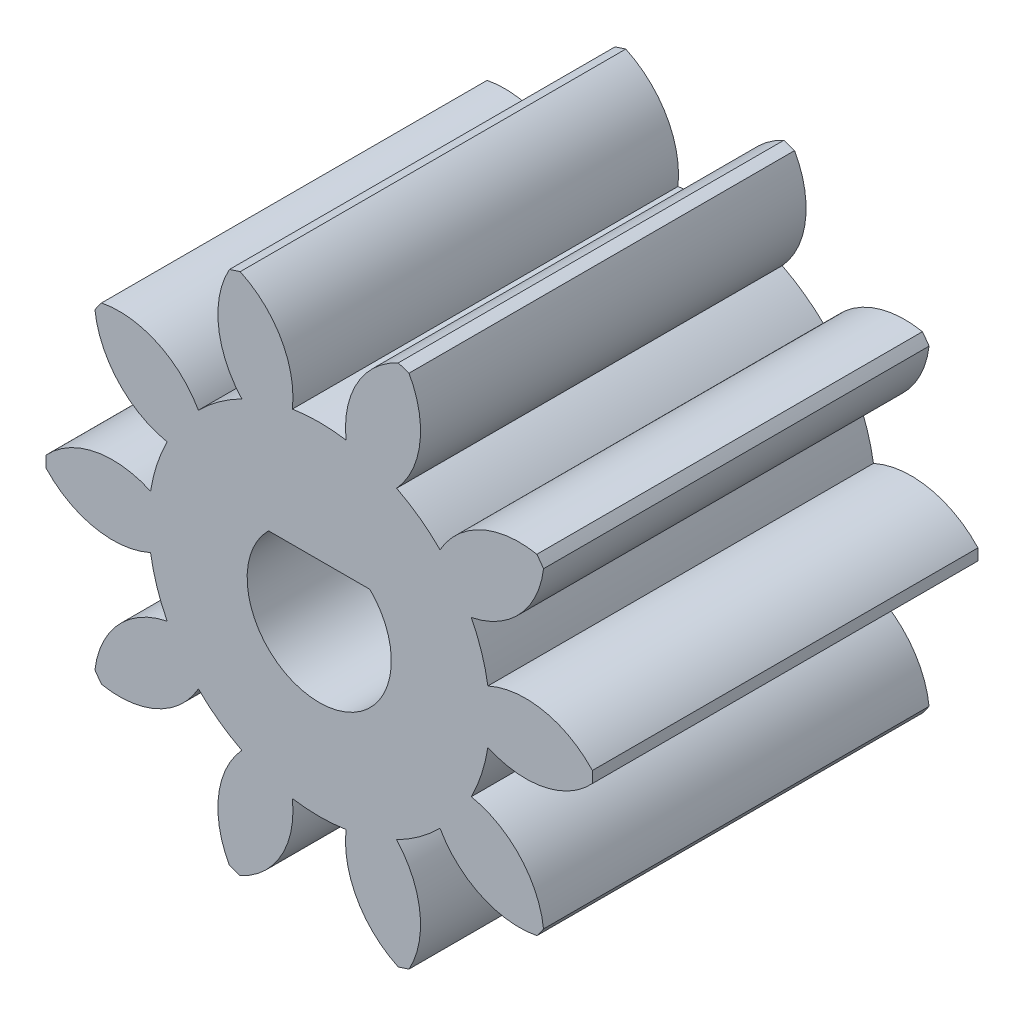
from build123d import *

# Parameters (mm, degrees)
BOSS_EXTRUDE1_DEPTH = 12.7
CUT_EXTRUDE1_REACH  = 19.791


with BuildPart() as part:
    # Sketch1 → Boss-Extrude1 (new body)
    with BuildSketch(Plane.XY):
        with BuildLine():
            ThreePointArc((-7.16977096, 5.440072093), (-7.281152949, 5.290067271), (-7.389397086, 5.137782665))
            ThreePointArc((-7.389397086, 5.137782665), (-6.616232826, 3.46280058), (-5.009138832, 2.556932568))
            ThreePointArc((-5.009138832, 2.556932568), (-5.348741848, 1.737911576), (-5.555405697, 0.875696031))
            ThreePointArc((-5.555405697, 0.875696031), (-7.388027907, 1.087459563), (-8.9980607, 0.186825141))
            ThreePointArc((-8.9980607, 0.186825141), (-9, 0), (-8.9980607, -0.186825141))
            ThreePointArc((-8.9980607, -0.186825141), (-7.388027907, -1.087459563), (-5.555405697, -0.875696031))
            ThreePointArc((-5.555405697, -0.875696031), (-5.348741848, -1.737911576), (-5.009138832, -2.556932568))
            ThreePointArc((-5.009138832, -2.556932568), (-6.616232826, -3.46280058), (-7.389397086, -5.137782665))
            ThreePointArc((-7.389397086, -5.137782665), (-7.281152949, -5.290067271), (-7.16977096, -5.440072093))
            ThreePointArc((-7.16977096, -5.440072093), (-5.337847438, -5.222347115), (-3.979696407, -3.97383851))
            ThreePointArc((-3.979696407, -3.97383851), (-3.305704259, -4.549911576), (-2.549551188, -5.012899834))
            ThreePointArc((-2.549551188, -5.012899834), (-3.317261682, -6.690388598), (-2.958234941, -8.49993212))
            ThreePointArc((-2.958234941, -8.49993212), (-2.781152949, -8.559508647), (-2.602872405, -8.615396407))
            ThreePointArc((-2.602872405, -8.615396407), (-1.248790674, -7.362475569), (-0.883878355, -5.554109745))
            ThreePointArc((-0.883878355, -5.554109745), (0, -5.624), (0.883878355, -5.554109745))
            ThreePointArc((0.883878355, -5.554109745), (1.248790674, -7.362475569), (2.602872405, -8.615396407))
            ThreePointArc((2.602872405, -8.615396407), (2.781152949, -8.559508647), (2.958234941, -8.49993212))
            ThreePointArc((2.958234941, -8.49993212), (3.317261682, -6.690388598), (2.549551188, -5.012899834))
            ThreePointArc((2.549551188, -5.012899834), (3.305704259, -4.549911576), (3.979696407, -3.97383851))
            ThreePointArc((3.979696407, -3.97383851), (5.337847438, -5.222347115), (7.16977096, -5.440072093))
            ThreePointArc((7.16977096, -5.440072093), (7.281152949, -5.290067271), (7.389397086, -5.137782665))
            ThreePointArc((7.389397086, -5.137782665), (6.616232826, -3.46280058), (5.009138832, -2.556932568))
            ThreePointArc((5.009138832, -2.556932568), (5.348741848, -1.737911576), (5.555405697, -0.875696031))
            ThreePointArc((5.555405697, -0.875696031), (7.388027907, -1.087459563), (8.9980607, -0.186825141))
            ThreePointArc((8.9980607, -0.186825141), (9, 0), (8.9980607, 0.186825141))
            ThreePointArc((8.9980607, 0.186825141), (7.388027907, 1.087459563), (5.555405697, 0.875696031))
            ThreePointArc((5.555405697, 0.875696031), (5.348741848, 1.737911576), (5.009138832, 2.556932568))
            ThreePointArc((5.009138832, 2.556932568), (6.616232826, 3.46280058), (7.389397086, 5.137782665))
            ThreePointArc((7.389397086, 5.137782665), (7.281152949, 5.290067271), (7.16977096, 5.440072093))
            ThreePointArc((7.16977096, 5.440072093), (5.337847438, 5.222347115), (3.979696407, 3.97383851))
            ThreePointArc((3.979696407, 3.97383851), (3.305704259, 4.549911576), (2.549551188, 5.012899834))
            ThreePointArc((2.549551188, 5.012899834), (3.317261682, 6.690388598), (2.958234941, 8.49993212))
            ThreePointArc((2.958234941, 8.49993212), (2.781152949, 8.559508647), (2.602872405, 8.615396407))
            ThreePointArc((2.602872405, 8.615396407), (1.248790674, 7.362475569), (0.883878355, 5.554109745))
            ThreePointArc((0.883878355, 5.554109745), (0, 5.624), (-0.883878355, 5.554109745))
            ThreePointArc((-0.883878355, 5.554109745), (-1.248790674, 7.362475569), (-2.602872405, 8.615396407))
            ThreePointArc((-2.602872405, 8.615396407), (-2.781152949, 8.559508647), (-2.958234941, 8.49993212))
            ThreePointArc((-2.958234941, 8.49993212), (-3.317261682, 6.690388598), (-2.549551188, 5.012899834))
            ThreePointArc((-2.549551188, 5.012899834), (-3.305704259, 4.549911576), (-3.979696407, 3.97383851))
            ThreePointArc((-3.979696407, 3.97383851), (-5.337847438, 5.222347115), (-7.16977096, 5.440072093))
        make_face()
    extrude(amount=BOSS_EXTRUDE1_DEPTH)

    # Sketch2 → Cut-Extrude1 (cut, up to next)
    with BuildSketch(Plane.XY.offset(12.7), mode=Mode.PRIVATE) as cut_extrude1_sk1:
        with BuildLine():
            Line((1.669458355, 1.6891), (-1.669458355, 1.6891))
            ThreePointArc((-1.669458355, 1.6891), (0, -2.3749), (1.669458355, 1.6891))
        make_face()
    cut_extrude1_tool1 = extrude(cut_extrude1_sk1.sketch, amount=-CUT_EXTRUDE1_REACH, mode=Mode.PRIVATE) & part.part
    add(cut_extrude1_tool1.solids().sort_by_distance((0, -0.192165, 12.7))[0], mode=Mode.SUBTRACT)


solid = part.part
